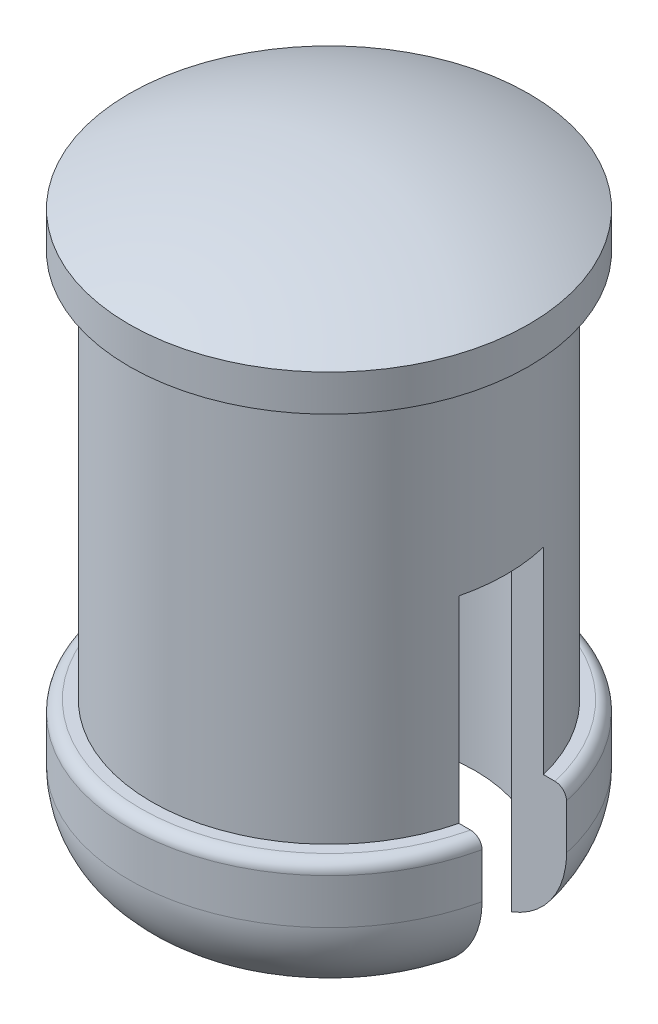
from build123d import *

# Parameters (mm, degrees)
SKETCH_4_R          = 2.6
CUT_EXTRUDE_1_DEPTH = 9
SKETCH_5_W          = 12.661838947
SKETCH_5_H          = 1.5
CUT_EXTRUDE_3_DEPTH = 6


with BuildPart() as part:
    # 草图3 → 旋转1 (revolve)
    with BuildSketch(Plane(origin=(0, 0, 0), x_dir=(0, 0, -1), z_dir=(1, 0, 0)), mode=Mode.PRIVATE) as revolve_1_sk:
        with BuildLine():
            Line((3.55, 10.047612555), (3.55, 9.4))
            Line((3.55, 9.4), (3.15, 9.4))
            Line((3.15, 9.4), (3.15, 2.5))
            Line((3.15, 2.5), (3.35, 2.5))
            ThreePointArc((3.35, 2.5), (3.491421356, 2.441421356), (3.55, 2.3))
            Line((3.55, 2.3), (3.55, 1.5))
            ThreePointArc((3.55, 1.5), (3.110660172, 0.439339828), (2.05, 0))
            Line((2.05, 0), (0, 0))
            Line((0, 0), (0, 10.9))
            ThreePointArc((0, 10.9), (1.825449558, 10.683917222), (3.55, 10.047612555))
        make_face()
    revolve(revolve_1_sk.sketch.rotate(Axis((0, 28.211895781, 0), (0, -1, 0)), 180), axis=Axis((0, 28.211895781, 0), (0, -1, 0)))

    # 草图4 → 切除-拉伸1 (cut)
    with BuildSketch(Plane.XZ):
        with Locations(Location((0, 0, 0), (0, 0, 270))):
            Circle(SKETCH_4_R)
    extrude(amount=-CUT_EXTRUDE_1_DEPTH, mode=Mode.SUBTRACT)

    # 草图5 → 切除-拉伸3 (cut)
    with BuildSketch(Plane(origin=(0, 0, 0), x_dir=(1, 0, 0), z_dir=(0, 1, 0))):
        with Locations((-0.07698047, 0)):
            Rectangle(SKETCH_5_W, SKETCH_5_H)
    extrude(amount=CUT_EXTRUDE_3_DEPTH, mode=Mode.SUBTRACT)


solid = part.part
